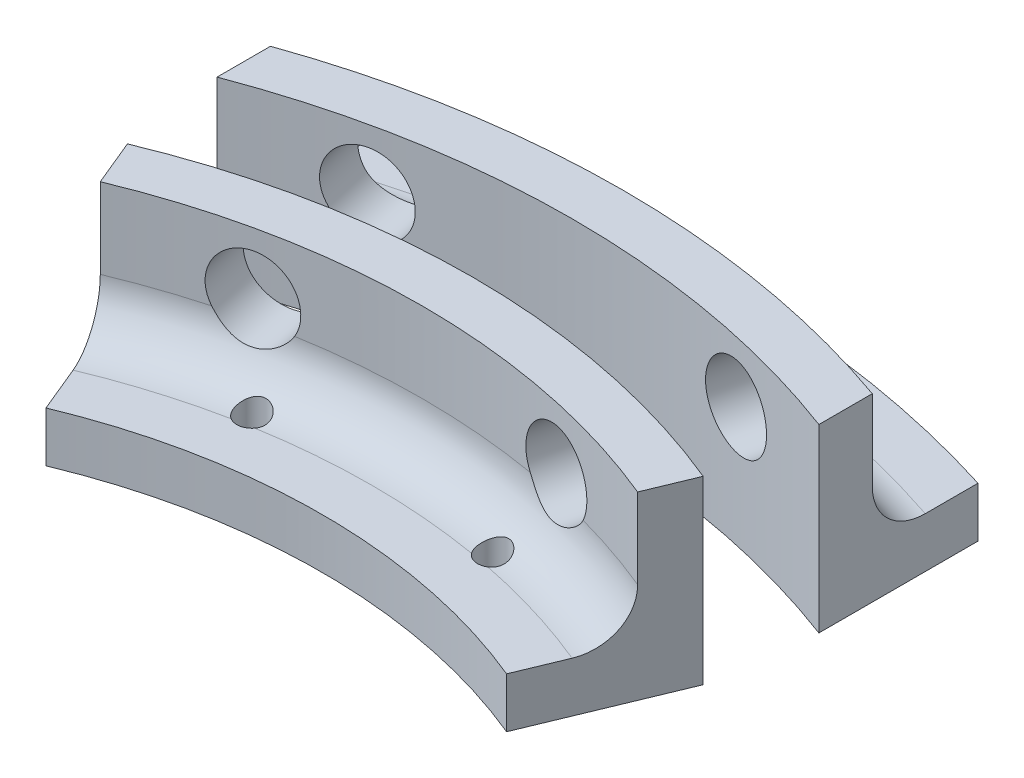
from build123d import *

# Parameters (mm, degrees)
BOSS_EXTRUDE1_DEPTH     = 18
BOSS_EXTRUDE1_2_DEPTH   = 18
CUT_EXTRUDE1_START      = -13
CUT_EXTRUDE1_DEPTH      = 13
FILLET1_R               = 5
FILLET2_R               = 5
SKETCH4_R               = 4
CUT_EXTRUDE2_DEPTH      = 76.458973142
CUT_EXTRUDE3_DEPTH      = 108.858546737
CUT_EXTRUDE3_DEPTH_BACK = 108.858546737
CUT_EXTRUDE4_DEPTH      = 109.574702879
CUT_EXTRUDE4_DEPTH_BACK = 109.574702879
SKETCH6_W               = 20
SKETCH6_H               = 180


with BuildPart() as part:
    # Sketch1 → Boss-Extrude1 (new body)
    with BuildSketch(Plane(origin=(0, 0, 0), x_dir=(1, 0, 0), z_dir=(0, 1, 0))):
        with BuildLine():
            Line((-22.961005942, 55.432771951), (-28.701257427, 69.290964938))
            ThreePointArc((-28.701257427, 69.290964938), (0, 75), (28.701257427, 69.290964938))
            Line((28.701257427, 69.290964938), (22.961005942, 55.432771951))
            ThreePointArc((22.961005942, 55.432771951), (0, 60), (-22.961005942, 55.432771951))
        make_face()
    extrude(amount=BOSS_EXTRUDE1_DEPTH)


with BuildPart() as body_2:
    # Sketch1 → Boss-Extrude1 2 (new body)
    with BuildSketch(Plane(origin=(0, 0, 0), x_dir=(1, 0, 0), z_dir=(0, 1, 0))):
        with BuildLine():
            Line((-32.528091751, 78.529760263), (-38.268343237, 92.387953251))
            ThreePointArc((-38.268343237, 92.387953251), (0, 100), (38.268343237, 92.387953251))
            Line((38.268343237, 92.387953251), (32.528091751, 78.529760263))
            ThreePointArc((32.528091751, 78.529760263), (0, 85), (-32.528091751, 78.529760263))
        make_face()
    extrude(amount=BOSS_EXTRUDE1_2_DEPTH)


with BuildPart() as cut_extrude1_tool:
    # Sketch2 → Cut-Extrude1 (new body)
    with BuildSketch(Plane(origin=(0, 18, 0), x_dir=(1, 0, 0), z_dir=(0, 1, 0)).offset(CUT_EXTRUDE1_START)):
        with BuildLine():
            Line((-22.961005942, 55.432771951), (-26.787840266, 64.671567276))
            ThreePointArc((-26.787840266, 64.671567276), (0, 70), (26.787840266, 64.671567276))
            Line((26.787840266, 64.671567276), (22.961005942, 55.432771951))
            ThreePointArc((22.961005942, 55.432771951), (0, 60), (-22.961005942, 55.432771951))
        make_face()
        with BuildLine():
            Line((-34.441508913, 83.149157926), (-40.181760398, 97.007350914))
            ThreePointArc((-40.181760398, 97.007350914), (0, 105), (40.181760398, 97.007350914))
            Line((40.181760398, 97.007350914), (34.441508913, 83.149157926))
            ThreePointArc((34.441508913, 83.149157926), (0, 90), (-34.441508913, 83.149157926))
        make_face()
    extrude(amount=CUT_EXTRUDE1_DEPTH)


with BuildPart() as part_1:
    add(part.part)

    # Cut-Extrude1: cut by cut_extrude1_tool
    add(cut_extrude1_tool.part, mode=Mode.SUBTRACT)

    # Fillet2
    fillet2_edges = [part_1.edges().sort_by_distance(p)[0] for p in [
        (0, 5, -70),
    ]]
    fillet(fillet2_edges, radius=FILLET2_R)


with BuildPart() as body_2_1:
    add(body_2.part)

    # Cut-Extrude1: cut by cut_extrude1_tool
    add(cut_extrude1_tool.part, mode=Mode.SUBTRACT)

    # Fillet1
    fillet1_edges = [body_2_1.edges().sort_by_distance(p)[0] for p in [
        (0, 5, -90),
    ]]
    fillet(fillet1_edges, radius=FILLET1_R)


with BuildPart() as cut_extrude2_tool:
    # Sketch4 → Cut-Extrude2 (new, symmetric)
    with BuildSketch(Plane(origin=(-21.643961394, 0, -97.629600712), x_dir=(-0.9762960071199331, 0, 0.21643961393810388), z_dir=(-0.2164396139381039, 0, -0.9762960071199333))):
        with Locations((0, 12)):
            Circle(SKETCH4_R)
    cut_extrude2 = extrude(amount=CUT_EXTRUDE2_DEPTH, both=True)


with BuildPart() as part_2:
    add(part_1.part)

    # Cut-Extrude2: cut by cut_extrude2_tool
    add(cut_extrude2_tool.part, mode=Mode.SUBTRACT)


with BuildPart() as body_2_2:
    add(body_2_1.part)

    # Cut-Extrude2: cut by cut_extrude2_tool
    add(cut_extrude2_tool.part, mode=Mode.SUBTRACT)


with BuildPart() as mirror1_tool:
    # Mirror1: Cut-Extrude2 across plane
    add(cut_extrude2.mirror(Plane(origin=(0, 0, 0), x_dir=(0, 0, 1), z_dir=(1, 0, 0))))


with BuildPart() as part_3:
    add(part_2.part)

    # Mirror1: cut by mirror1_tool
    add(mirror1_tool.part, mode=Mode.SUBTRACT)


with BuildPart() as body_2_3:
    add(body_2_2.part)

    # Mirror1: cut by mirror1_tool
    add(mirror1_tool.part, mode=Mode.SUBTRACT)


with BuildPart() as cut_extrude3_tool:
    # Sketch5 → Cut-Extrude3 (new, two sides: drawn at the far end of the back side and taken through both)
    with BuildSketch(Plane(origin=(0, 5, 0), x_dir=(1, 0, 0), z_dir=(0, 1, 0)).offset(-CUT_EXTRUDE3_DEPTH_BACK)):
        with BuildLine():
            ThreePointArc((-12, 93.5), (-10.939339828, 93.939339828), (-10.5, 95))
            Line((-10.5, 95), (-12, 95))
            Line((-12, 95), (-12, 93.5))
        make_face()
        with BuildLine():
            Line((-12, 95), (-10.5, 95))
            ThreePointArc((-10.5, 95), (-13.060660172, 96.060660172), (-12, 93.5))
            Line((-12, 93.5), (-12, 95))
        make_face()
        with BuildLine():
            ThreePointArc((13.5, 95), (12, 96.5), (10.5, 95))
            Line((10.5, 95), (12, 95))
            Line((12, 95), (12, 93.5))
            ThreePointArc((12, 93.5), (13.060660172, 93.939339828), (13.5, 95))
        make_face()
        with BuildLine():
            Line((12, 95), (10.5, 95))
            ThreePointArc((10.5, 95), (10.939339828, 93.939339828), (12, 93.5))
            Line((12, 93.5), (12, 95))
        make_face()
        with BuildLine():
            Line((-12, 65), (-12, 66.5))
            ThreePointArc((-12, 66.5), (-13.441827236, 65.413683723), (-12.795280612, 63.728178964))
            ThreePointArc((-12.795280612, 63.728178964), (-11.800586165, 63.919841725), (-10.803025636, 64.095979883))
            ThreePointArc((-10.803025636, 64.095979883), (-10.577772602, 64.523272376), (-10.5, 65))
            Line((-10.5, 65), (-12, 65))
        make_face()
        with BuildLine():
            ThreePointArc((-10.803025636, 64.095979883), (-11.800586165, 63.919841725), (-12.795280612, 63.728178964))
            ThreePointArc((-12.795280612, 63.728178964), (-11.727678781, 63.524926729), (-10.803025636, 64.095979883))
        make_face()
        with BuildLine():
            ThreePointArc((-10.5, 65), (-10.939339828, 66.060660172), (-12, 66.5))
            Line((-12, 66.5), (-12, 65))
            Line((-12, 65), (-10.5, 65))
        make_face()
        with BuildLine():
            ThreePointArc((10.803025636, 64.095979883), (11.727678781, 63.524926729), (12.795280612, 63.728178964))
            ThreePointArc((12.795280612, 63.728178964), (11.800586165, 63.919841725), (10.803025636, 64.095979883))
        make_face()
        with BuildLine():
            ThreePointArc((13.5, 65), (13.060660172, 66.060660172), (12, 66.5))
            Line((12, 66.5), (12, 65))
            Line((12, 65), (10.5, 65))
            ThreePointArc((10.5, 65), (10.577772602, 64.523272376), (10.803025636, 64.095979883))
            ThreePointArc((10.803025636, 64.095979883), (11.800586165, 63.919841725), (12.795280612, 63.728178964))
            ThreePointArc((12.795280612, 63.728178964), (13.312044382, 64.27299275), (13.5, 65))
        make_face()
        with BuildLine():
            Line((12, 65), (12, 66.5))
            ThreePointArc((12, 66.5), (10.939339828, 66.060660172), (10.5, 65))
            Line((10.5, 65), (12, 65))
        make_face()
    extrude(amount=CUT_EXTRUDE3_DEPTH + CUT_EXTRUDE3_DEPTH_BACK)


with BuildPart() as part_4:
    add(part_3.part)

    # Cut-Extrude3: cut by cut_extrude3_tool
    add(cut_extrude3_tool.part, mode=Mode.SUBTRACT)


with BuildPart() as body_2_4:
    add(body_2_3.part)

    # Cut-Extrude3: cut by cut_extrude3_tool
    add(cut_extrude3_tool.part, mode=Mode.SUBTRACT)

    # Sketch6 → Cut-Extrude4 (cut, two sides: drawn at the far end of the back side and taken through both)
    with BuildSketch(Plane.XZ.offset(-CUT_EXTRUDE4_DEPTH_BACK)):
        with Locations((-40, -90)):
            Rectangle(SKETCH6_W, SKETCH6_H)
        with Locations((40, -90)):
            Rectangle(SKETCH6_W, SKETCH6_H)
    extrude(amount=CUT_EXTRUDE4_DEPTH + CUT_EXTRUDE4_DEPTH_BACK, mode=Mode.SUBTRACT)


solid = Compound([part_4.part, body_2_4.part])
